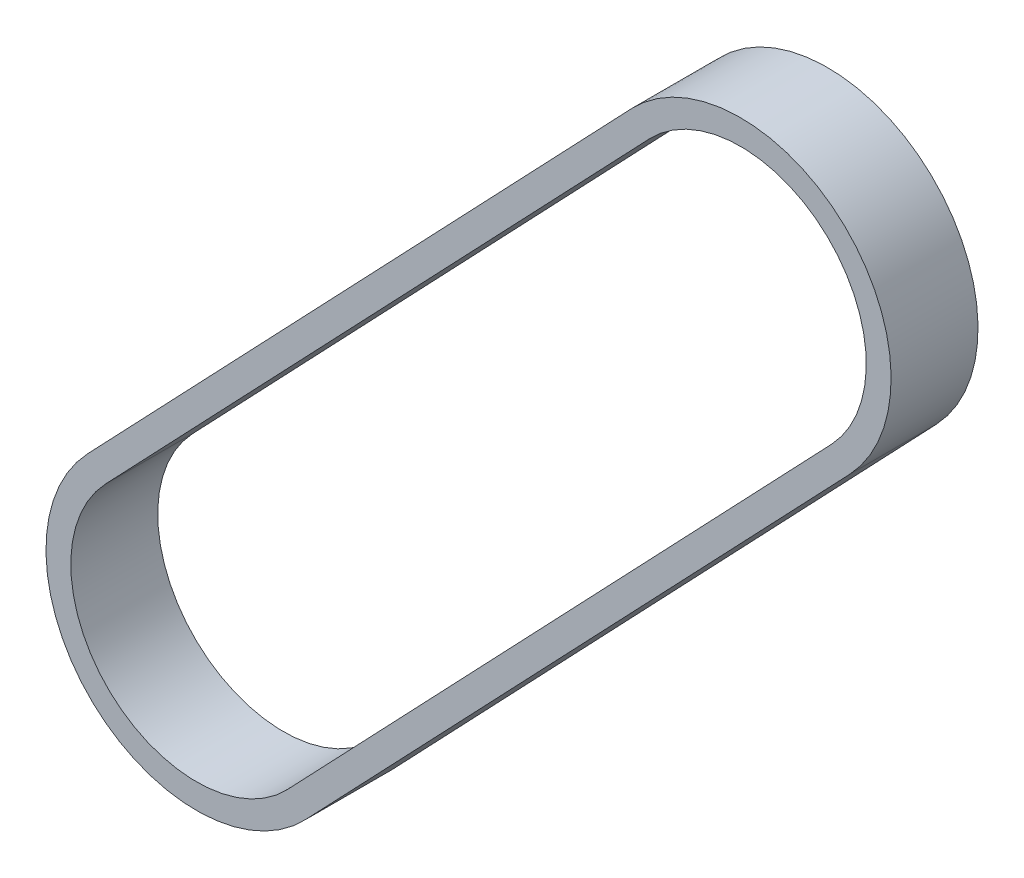
from build123d import *

# Parameters (mm, degrees)
EXTRUDE_1_DEPTH = 7


with BuildPart() as part:
    # 草图2 → 拉伸-薄壁1 (new body)
    with BuildSketch(Plane.XY):
        with BuildLine():
            Line((-42.583757596, -37.609696046), (1.21895964, 8.363904669))
            ThreePointArc((1.21895964, 8.363904669), (18.361288068, 8.778423759), (18.775807158, -8.363904669))
            Line((18.775807158, -8.363904669), (-25.026910079, -54.337505384))
            ThreePointArc((-25.026910079, -54.337505384), (-42.169238506, -54.752024474), (-42.583757596, -37.609696046))
        make_face()
        with BuildLine():
            Line((-41.135770172, -38.989309187), (2.666947064, 6.984291528))
            ThreePointArc((2.666947064, 6.984291528), (16.981674927, 7.330436335), (17.327819733, -6.984291528))
            Line((17.327819733, -6.984291528), (-26.474897503, -52.957892243))
            ThreePointArc((-26.474897503, -52.957892243), (-40.789625365, -53.30403705), (-41.135770172, -38.989309187))
        make_face(mode=Mode.SUBTRACT)
    extrude(amount=EXTRUDE_1_DEPTH)


solid = part.part
